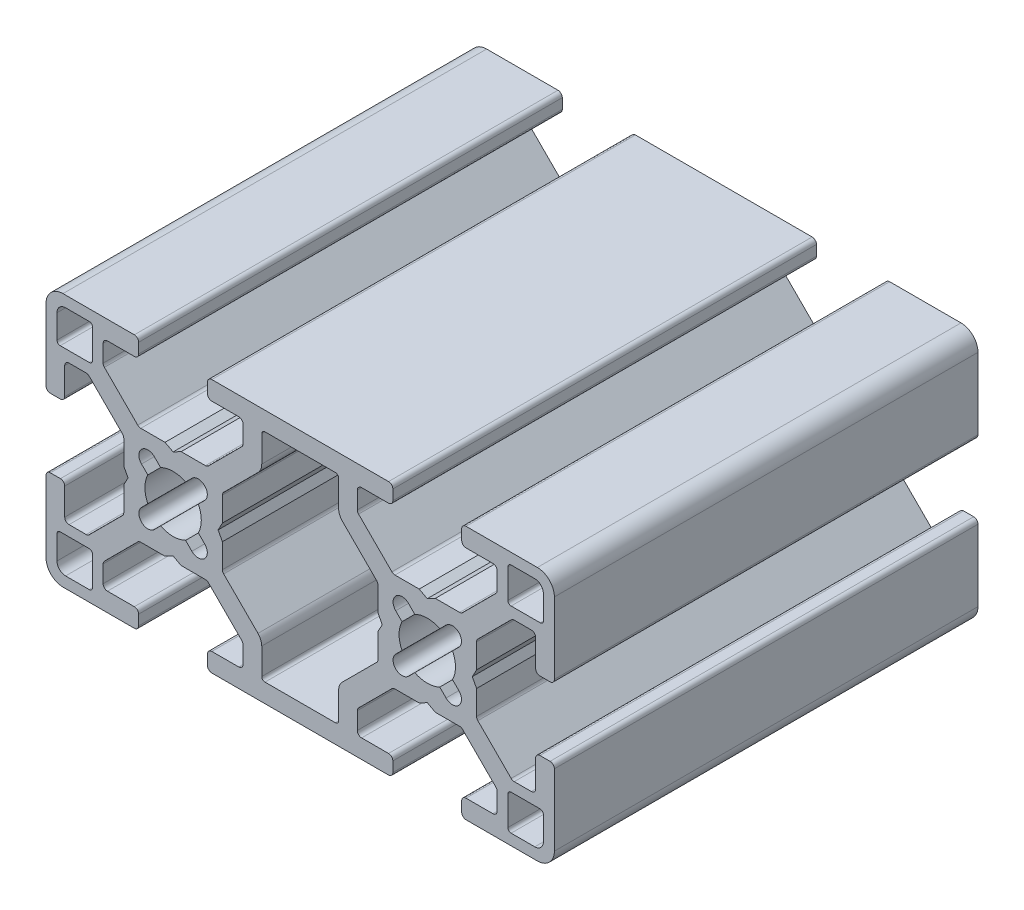
from build123d import *

# Parameters (mm, degrees)
EXTRUDE1_DEPTH = 50


with BuildPart() as part:
    # Sketch1 → Extrude1 (new body)
    with BuildSketch(Plane.XY):
        with BuildLine():
            Line((-10.428, -15), (10.428, -15))
            ThreePointArc((10.428, -15), (10.787210245, -14.851210245), (10.936, -14.492))
            Line((10.936, -14.492), (10.936, -13.2982))
            ThreePointArc((10.936, -13.2982), (10.787210245, -12.938989755), (10.428, -12.7902))
            Line((10.428, -12.7902), (7.253, -12.7902))
            ThreePointArc((7.253, -12.7902), (6.893789755, -12.641410245), (6.745, -12.2822))
            Line((6.745, -12.2822), (6.745, -10.261471714))
            ThreePointArc((6.745, -10.261471714), (6.783669197, -10.06706853), (6.893789755, -9.902261469))
            Line((6.893789755, -9.902261469), (10.825246067, -5.970805157))
            ThreePointArc((10.825246067, -5.970805157), (10.990053129, -5.860684599), (11.184456312, -5.822015402))
            Line((11.184456312, -5.822015402), (14.0475, -5.822015402))
            Line((14.0475, -5.822015402), (15, -5.314015402))
            Line((15, -5.314015402), (15.9525, -5.822015402))
            Line((15.9525, -5.822015402), (18.815543688, -5.822015402))
            ThreePointArc((18.815543688, -5.822015402), (19.009946871, -5.860684599), (19.174753933, -5.970805157))
            Line((19.174753933, -5.970805157), (23.106210245, -9.902261469))
            ThreePointArc((23.106210245, -9.902261469), (23.216330803, -10.06706853), (23.255, -10.261471714))
            Line((23.255, -10.261471714), (23.255, -12.2822))
            ThreePointArc((23.255, -12.2822), (23.106210245, -12.641410245), (22.747, -12.7902))
            Line((22.747, -12.7902), (19.572, -12.7902))
            ThreePointArc((19.572, -12.7902), (19.212789755, -12.938989755), (19.064, -13.2982))
            Line((19.064, -13.2982), (19.064, -14.492))
            ThreePointArc((19.064, -14.492), (19.212789755, -14.851210245), (19.572, -15))
            Line((19.572, -15), (27.9934, -15))
            ThreePointArc((27.9934, -15), (29.412280467, -14.412280467), (30, -12.9934))
            Line((30, -12.9934), (30, -4.572))
            ThreePointArc((30, -4.572), (29.851210245, -4.212789755), (29.492, -4.064))
            Line((29.492, -4.064), (28.2982, -4.064))
            ThreePointArc((28.2982, -4.064), (27.938989755, -4.212789755), (27.7902, -4.572))
            Line((27.7902, -4.572), (27.7902, -7.747))
            ThreePointArc((27.7902, -7.747), (27.641410245, -8.106210245), (27.2822, -8.255))
            Line((27.2822, -8.255), (25.261471714, -8.255))
            ThreePointArc((25.261471714, -8.255), (25.06706853, -8.216330803), (24.902261469, -8.106210245))
            Line((24.902261469, -8.106210245), (20.970805157, -4.174753933))
            ThreePointArc((20.970805157, -4.174753933), (20.860684599, -4.009946871), (20.822015402, -3.815543688))
            Line((20.822015402, -3.815543688), (20.822015402, -0.9525))
            Line((20.822015402, -0.9525), (20.314015402, 0))
            Line((20.314015402, 0), (20.822015402, 0.9525))
            Line((20.822015402, 0.9525), (20.822015402, 3.815543688))
            ThreePointArc((20.822015402, 3.815543688), (20.860684599, 4.009946871), (20.970805157, 4.174753933))
            Line((20.970805157, 4.174753933), (24.902261469, 8.106210245))
            ThreePointArc((24.902261469, 8.106210245), (25.06706853, 8.216330803), (25.261471714, 8.255))
            Line((25.261471714, 8.255), (27.2822, 8.255))
            ThreePointArc((27.2822, 8.255), (27.641410245, 8.106210245), (27.7902, 7.747))
            Line((27.7902, 7.747), (27.7902, 4.572))
            ThreePointArc((27.7902, 4.572), (27.938989755, 4.212789755), (28.2982, 4.064))
            Line((28.2982, 4.064), (29.492, 4.064))
            ThreePointArc((29.492, 4.064), (29.851210245, 4.212789755), (30, 4.572))
            Line((30, 4.572), (30, 12.9934))
            ThreePointArc((30, 12.9934), (29.412280467, 14.412280467), (27.9934, 15))
            Line((27.9934, 15), (19.572, 15))
            ThreePointArc((19.572, 15), (19.212789755, 14.851210245), (19.064, 14.492))
            Line((19.064, 14.492), (19.064, 13.2982))
            ThreePointArc((19.064, 13.2982), (19.212789755, 12.938989755), (19.572, 12.7902))
            Line((19.572, 12.7902), (22.747, 12.7902))
            ThreePointArc((22.747, 12.7902), (23.106210245, 12.641410245), (23.255, 12.2822))
            Line((23.255, 12.2822), (23.255, 10.261471714))
            ThreePointArc((23.255, 10.261471714), (23.216330803, 10.06706853), (23.106210245, 9.902261469))
            Line((23.106210245, 9.902261469), (19.174753933, 5.970805157))
            ThreePointArc((19.174753933, 5.970805157), (19.009946871, 5.860684599), (18.815543688, 5.822015402))
            Line((18.815543688, 5.822015402), (15.9525, 5.822015402))
            Line((15.9525, 5.822015402), (15, 5.314015402))
            Line((15, 5.314015402), (14.0475, 5.822015402))
            Line((14.0475, 5.822015402), (11.184456312, 5.822015402))
            ThreePointArc((11.184456312, 5.822015402), (10.990053129, 5.860684599), (10.825246067, 5.970805157))
            Line((10.825246067, 5.970805157), (6.893789755, 9.902261469))
            ThreePointArc((6.893789755, 9.902261469), (6.783669197, 10.06706853), (6.745, 10.261471714))
            Line((6.745, 10.261471714), (6.745, 12.2822))
            ThreePointArc((6.745, 12.2822), (6.893789755, 12.641410245), (7.253, 12.7902))
            Line((7.253, 12.7902), (10.428, 12.7902))
            ThreePointArc((10.428, 12.7902), (10.787210245, 12.938989755), (10.936, 13.2982))
            Line((10.936, 13.2982), (10.936, 14.492))
            ThreePointArc((10.936, 14.492), (10.787210245, 14.851210245), (10.428, 15))
            Line((10.428, 15), (-10.428, 15))
            ThreePointArc((-10.428, 15), (-10.787210245, 14.851210245), (-10.936, 14.492))
            Line((-10.936, 14.492), (-10.936, 13.2982))
            ThreePointArc((-10.936, 13.2982), (-10.787210245, 12.938989755), (-10.428, 12.7902))
            Line((-10.428, 12.7902), (-7.253, 12.7902))
            ThreePointArc((-7.253, 12.7902), (-6.893789755, 12.641410245), (-6.745, 12.2822))
            Line((-6.745, 12.2822), (-6.745, 10.261471714))
            ThreePointArc((-6.745, 10.261471714), (-6.783669197, 10.06706853), (-6.893789755, 9.902261469))
            Line((-6.893789755, 9.902261469), (-10.825246067, 5.970805157))
            ThreePointArc((-10.825246067, 5.970805157), (-10.990053129, 5.860684599), (-11.184456312, 5.822015402))
            Line((-11.184456312, 5.822015402), (-14.0475, 5.822015402))
            Line((-14.0475, 5.822015402), (-15, 5.314015402))
            Line((-15, 5.314015402), (-15.9525, 5.822015402))
            Line((-15.9525, 5.822015402), (-18.815543688, 5.822015402))
            ThreePointArc((-18.815543688, 5.822015402), (-19.009946871, 5.860684599), (-19.174753933, 5.970805157))
            Line((-19.174753933, 5.970805157), (-23.106210245, 9.902261469))
            ThreePointArc((-23.106210245, 9.902261469), (-23.216330803, 10.06706853), (-23.255, 10.261471714))
            Line((-23.255, 10.261471714), (-23.255, 12.2822))
            ThreePointArc((-23.255, 12.2822), (-23.106210245, 12.641410245), (-22.747, 12.7902))
            Line((-22.747, 12.7902), (-19.572, 12.7902))
            ThreePointArc((-19.572, 12.7902), (-19.212789755, 12.938989755), (-19.064, 13.2982))
            Line((-19.064, 13.2982), (-19.064, 14.492))
            ThreePointArc((-19.064, 14.492), (-19.212789755, 14.851210245), (-19.572, 15))
            Line((-19.572, 15), (-27.9934, 15))
            ThreePointArc((-27.9934, 15), (-29.412280467, 14.412280467), (-30, 12.9934))
            Line((-30, 12.9934), (-30, 4.572))
            ThreePointArc((-30, 4.572), (-29.851210245, 4.212789755), (-29.492, 4.064))
            Line((-29.492, 4.064), (-28.2982, 4.064))
            ThreePointArc((-28.2982, 4.064), (-27.938989755, 4.212789755), (-27.7902, 4.572))
            Line((-27.7902, 4.572), (-27.7902, 7.747))
            ThreePointArc((-27.7902, 7.747), (-27.641410245, 8.106210245), (-27.2822, 8.255))
            Line((-27.2822, 8.255), (-25.261471714, 8.255))
            ThreePointArc((-25.261471714, 8.255), (-25.06706853, 8.216330803), (-24.902261469, 8.106210245))
            Line((-24.902261469, 8.106210245), (-20.970805157, 4.174753933))
            ThreePointArc((-20.970805157, 4.174753933), (-20.860684599, 4.009946871), (-20.822015402, 3.815543688))
            Line((-20.822015402, 3.815543688), (-20.822015402, 0.9525))
            Line((-20.822015402, 0.9525), (-20.314015402, 0))
            Line((-20.314015402, 0), (-20.822015402, -0.9525))
            Line((-20.822015402, -0.9525), (-20.822015402, -3.815543688))
            ThreePointArc((-20.822015402, -3.815543688), (-20.860684599, -4.009946871), (-20.970805157, -4.174753933))
            Line((-20.970805157, -4.174753933), (-24.902261469, -8.106210245))
            ThreePointArc((-24.902261469, -8.106210245), (-25.06706853, -8.216330803), (-25.261471714, -8.255))
            Line((-25.261471714, -8.255), (-27.2822, -8.255))
            ThreePointArc((-27.2822, -8.255), (-27.641410245, -8.106210245), (-27.7902, -7.747))
            Line((-27.7902, -7.747), (-27.7902, -4.572))
            ThreePointArc((-27.7902, -4.572), (-27.938989755, -4.212789755), (-28.2982, -4.064))
            Line((-28.2982, -4.064), (-29.492, -4.064))
            ThreePointArc((-29.492, -4.064), (-29.851210245, -4.212789755), (-30, -4.572))
            Line((-30, -4.572), (-30, -12.9934))
            ThreePointArc((-30, -12.9934), (-29.412280467, -14.412280467), (-27.9934, -15))
            Line((-27.9934, -15), (-19.572, -15))
            ThreePointArc((-19.572, -15), (-19.212789755, -14.851210245), (-19.064, -14.492))
            Line((-19.064, -14.492), (-19.064, -13.2982))
            ThreePointArc((-19.064, -13.2982), (-19.212789755, -12.938989755), (-19.572, -12.7902))
            Line((-19.572, -12.7902), (-22.747, -12.7902))
            ThreePointArc((-22.747, -12.7902), (-23.106210245, -12.641410245), (-23.255, -12.2822))
            Line((-23.255, -12.2822), (-23.255, -10.261471714))
            ThreePointArc((-23.255, -10.261471714), (-23.216330803, -10.06706853), (-23.106210245, -9.902261469))
            Line((-23.106210245, -9.902261469), (-19.174753933, -5.970805157))
            ThreePointArc((-19.174753933, -5.970805157), (-19.009946871, -5.860684599), (-18.815543688, -5.822015402))
            Line((-18.815543688, -5.822015402), (-15.9525, -5.822015402))
            Line((-15.9525, -5.822015402), (-15, -5.314015402))
            Line((-15, -5.314015402), (-14.0475, -5.822015402))
            Line((-14.0475, -5.822015402), (-11.184456312, -5.822015402))
            ThreePointArc((-11.184456312, -5.822015402), (-10.990053129, -5.860684599), (-10.825246067, -5.970805157))
            Line((-10.825246067, -5.970805157), (-6.893789755, -9.902261469))
            ThreePointArc((-6.893789755, -9.902261469), (-6.783669197, -10.06706853), (-6.745, -10.261471714))
            Line((-6.745, -10.261471714), (-6.745, -12.2822))
            ThreePointArc((-6.745, -12.2822), (-6.893789755, -12.641410245), (-7.253, -12.7902))
            Line((-7.253, -12.7902), (-10.428, -12.7902))
            ThreePointArc((-10.428, -12.7902), (-10.787210245, -12.938989755), (-10.936, -13.2982))
            Line((-10.936, -13.2982), (-10.936, -14.492))
            ThreePointArc((-10.936, -14.492), (-10.787210245, -14.851210245), (-10.428, -15))
        make_face()
        with BuildLine():
            Line((12.782541514, 3.726141514), (13.525717665, 2.982965363))
            ThreePointArc((13.525717665, 2.982965363), (15, 3.3274), (16.474282335, 2.982965363))
            Line((16.474282335, 2.982965363), (17.217458486, 3.726141514))
            ThreePointArc((17.217458486, 3.726141514), (18.726141514, 3.726141514), (18.726141514, 2.217458486))
            Line((18.726141514, 2.217458486), (17.982965363, 1.474282335))
            ThreePointArc((17.982965363, 1.474282335), (18.3274, 0), (17.982965363, -1.474282335))
            Line((17.982965363, -1.474282335), (18.726141514, -2.217458486))
            ThreePointArc((18.726141514, -2.217458486), (18.726141514, -3.726141514), (17.217458486, -3.726141514))
            Line((17.217458486, -3.726141514), (16.474282335, -2.982965363))
            ThreePointArc((16.474282335, -2.982965363), (15, -3.3274), (13.525717665, -2.982965363))
            Line((13.525717665, -2.982965363), (12.782541514, -3.726141514))
            ThreePointArc((12.782541514, -3.726141514), (11.273858486, -3.726141514), (11.273858486, -2.217458486))
            Line((11.273858486, -2.217458486), (12.017034637, -1.474282335))
            ThreePointArc((12.017034637, -1.474282335), (11.6726, 0), (12.017034637, 1.474282335))
            Line((12.017034637, 1.474282335), (11.273858486, 2.217458486))
            ThreePointArc((11.273858486, 2.217458486), (11.273858486, 3.726141514), (12.782541514, 3.726141514))
        make_face(mode=Mode.SUBTRACT)
        with BuildLine():
            Line((-28.7046, 9.8946), (-28.7046, 12.6886))
            ThreePointArc((-28.7046, 12.6886), (-28.40702049, 13.40702049), (-27.6886, 13.7046))
            Line((-27.6886, 13.7046), (-24.8946, 13.7046))
            ThreePointArc((-24.8946, 13.7046), (-24.625192316, 13.593007684), (-24.5136, 13.3236))
            Line((-24.5136, 13.3236), (-24.5136, 9.8946))
            ThreePointArc((-24.5136, 9.8946), (-24.625192316, 9.625192316), (-24.8946, 9.5136))
            Line((-24.8946, 9.5136), (-28.3236, 9.5136))
            ThreePointArc((-28.3236, 9.5136), (-28.593007684, 9.625192316), (-28.7046, 9.8946))
        make_face(mode=Mode.SUBTRACT)
        with BuildLine():
            Line((-24.8946, -13.7046), (-27.6886, -13.7046))
            ThreePointArc((-27.6886, -13.7046), (-28.40702049, -13.40702049), (-28.7046, -12.6886))
            Line((-28.7046, -12.6886), (-28.7046, -9.8946))
            ThreePointArc((-28.7046, -9.8946), (-28.593007684, -9.625192316), (-28.3236, -9.5136))
            Line((-28.3236, -9.5136), (-24.8946, -9.5136))
            ThreePointArc((-24.8946, -9.5136), (-24.625192316, -9.625192316), (-24.5136, -9.8946))
            Line((-24.5136, -9.8946), (-24.5136, -13.3236))
            ThreePointArc((-24.5136, -13.3236), (-24.625192316, -13.593007684), (-24.8946, -13.7046))
        make_face(mode=Mode.SUBTRACT)
        with BuildLine():
            Line((4.981569265, 8.22237951), (9.029194843, 4.174753933))
            ThreePointArc((9.029194843, 4.174753933), (9.139315401, 4.009946871), (9.177984598, 3.815543688))
            Line((9.177984598, 3.815543688), (9.177984598, 0.9525))
            Line((9.177984598, 0.9525), (9.685984598, 0))
            Line((9.685984598, 0), (9.177984598, -0.9525))
            Line((9.177984598, -0.9525), (9.177984598, -3.815543688))
            ThreePointArc((9.177984598, -3.815543688), (9.139315401, -4.009946871), (9.029194843, -4.174753933))
            Line((9.029194843, -4.174753933), (4.981569265, -8.22237951))
            ThreePointArc((4.981569265, -8.22237951), (4.651207592, -8.716800694), (4.5352, -9.300010245))
            Line((4.5352, -9.300010245), (4.5352, -12.4092))
            ThreePointArc((4.5352, -12.4092), (4.423607684, -12.678607684), (4.1542, -12.7902))
            Line((4.1542, -12.7902), (-4.1542, -12.7902))
            ThreePointArc((-4.1542, -12.7902), (-4.423607684, -12.678607684), (-4.5352, -12.4092))
            Line((-4.5352, -12.4092), (-4.5352, -9.300010245))
            ThreePointArc((-4.5352, -9.300010245), (-4.651207592, -8.716800694), (-4.981569265, -8.22237951))
            Line((-4.981569265, -8.22237951), (-9.029194843, -4.174753933))
            ThreePointArc((-9.029194843, -4.174753933), (-9.139315401, -4.009946871), (-9.177984598, -3.815543688))
            Line((-9.177984598, -3.815543688), (-9.177984598, -0.9525))
            Line((-9.177984598, -0.9525), (-9.685984598, 0))
            Line((-9.685984598, 0), (-9.177984598, 0.9525))
            Line((-9.177984598, 0.9525), (-9.177984598, 3.815543688))
            ThreePointArc((-9.177984598, 3.815543688), (-9.139315401, 4.009946871), (-9.029194843, 4.174753933))
            Line((-9.029194843, 4.174753933), (-4.981569265, 8.22237951))
            ThreePointArc((-4.981569265, 8.22237951), (-4.651207592, 8.716800694), (-4.5352, 9.300010245))
            Line((-4.5352, 9.300010245), (-4.5352, 12.4092))
            ThreePointArc((-4.5352, 12.4092), (-4.423607684, 12.678607684), (-4.1542, 12.7902))
            Line((-4.1542, 12.7902), (4.1542, 12.7902))
            ThreePointArc((4.1542, 12.7902), (4.423607684, 12.678607684), (4.5352, 12.4092))
            Line((4.5352, 12.4092), (4.5352, 9.300010245))
            ThreePointArc((4.5352, 9.300010245), (4.651207592, 8.716800694), (4.981569265, 8.22237951))
        make_face(mode=Mode.SUBTRACT)
        with BuildLine():
            Line((-18.726141514, -2.217458486), (-17.982965363, -1.474282335))
            ThreePointArc((-17.982965363, -1.474282335), (-18.3274, 0), (-17.982965363, 1.474282335))
            Line((-17.982965363, 1.474282335), (-18.726141514, 2.217458486))
            ThreePointArc((-18.726141514, 2.217458486), (-18.726141514, 3.726141514), (-17.217458486, 3.726141514))
            Line((-17.217458486, 3.726141514), (-16.474282335, 2.982965363))
            ThreePointArc((-16.474282335, 2.982965363), (-15, 3.3274), (-13.525717665, 2.982965363))
            Line((-13.525717665, 2.982965363), (-12.782541514, 3.726141514))
            ThreePointArc((-12.782541514, 3.726141514), (-11.273858486, 3.726141514), (-11.273858486, 2.217458486))
            Line((-11.273858486, 2.217458486), (-12.017034637, 1.474282335))
            ThreePointArc((-12.017034637, 1.474282335), (-11.6726, 0), (-12.017034637, -1.474282335))
            Line((-12.017034637, -1.474282335), (-11.273858486, -2.217458486))
            ThreePointArc((-11.273858486, -2.217458486), (-11.273858486, -3.726141514), (-12.782541514, -3.726141514))
            Line((-12.782541514, -3.726141514), (-13.525717665, -2.982965363))
            ThreePointArc((-13.525717665, -2.982965363), (-15, -3.3274), (-16.474282335, -2.982965363))
            Line((-16.474282335, -2.982965363), (-17.217458486, -3.726141514))
            ThreePointArc((-17.217458486, -3.726141514), (-18.726141514, -3.726141514), (-18.726141514, -2.217458486))
        make_face(mode=Mode.SUBTRACT)
        with BuildLine():
            Line((24.8946, 13.7046), (27.6886, 13.7046))
            ThreePointArc((27.6886, 13.7046), (28.40702049, 13.40702049), (28.7046, 12.6886))
            Line((28.7046, 12.6886), (28.7046, 9.8946))
            ThreePointArc((28.7046, 9.8946), (28.593007684, 9.625192316), (28.3236, 9.5136))
            Line((28.3236, 9.5136), (24.8946, 9.5136))
            ThreePointArc((24.8946, 9.5136), (24.625192316, 9.625192316), (24.5136, 9.8946))
            Line((24.5136, 9.8946), (24.5136, 13.3236))
            ThreePointArc((24.5136, 13.3236), (24.625192316, 13.593007684), (24.8946, 13.7046))
        make_face(mode=Mode.SUBTRACT)
        with BuildLine():
            Line((24.5136, -13.3236), (24.5136, -9.8946))
            ThreePointArc((24.5136, -9.8946), (24.625192316, -9.625192316), (24.8946, -9.5136))
            Line((24.8946, -9.5136), (28.3236, -9.5136))
            ThreePointArc((28.3236, -9.5136), (28.593007684, -9.625192316), (28.7046, -9.8946))
            Line((28.7046, -9.8946), (28.7046, -12.6886))
            ThreePointArc((28.7046, -12.6886), (28.40702049, -13.40702049), (27.6886, -13.7046))
            Line((27.6886, -13.7046), (24.8946, -13.7046))
            ThreePointArc((24.8946, -13.7046), (24.625192316, -13.593007684), (24.5136, -13.3236))
        make_face(mode=Mode.SUBTRACT)
    extrude(amount=-EXTRUDE1_DEPTH)


solid = part.part
